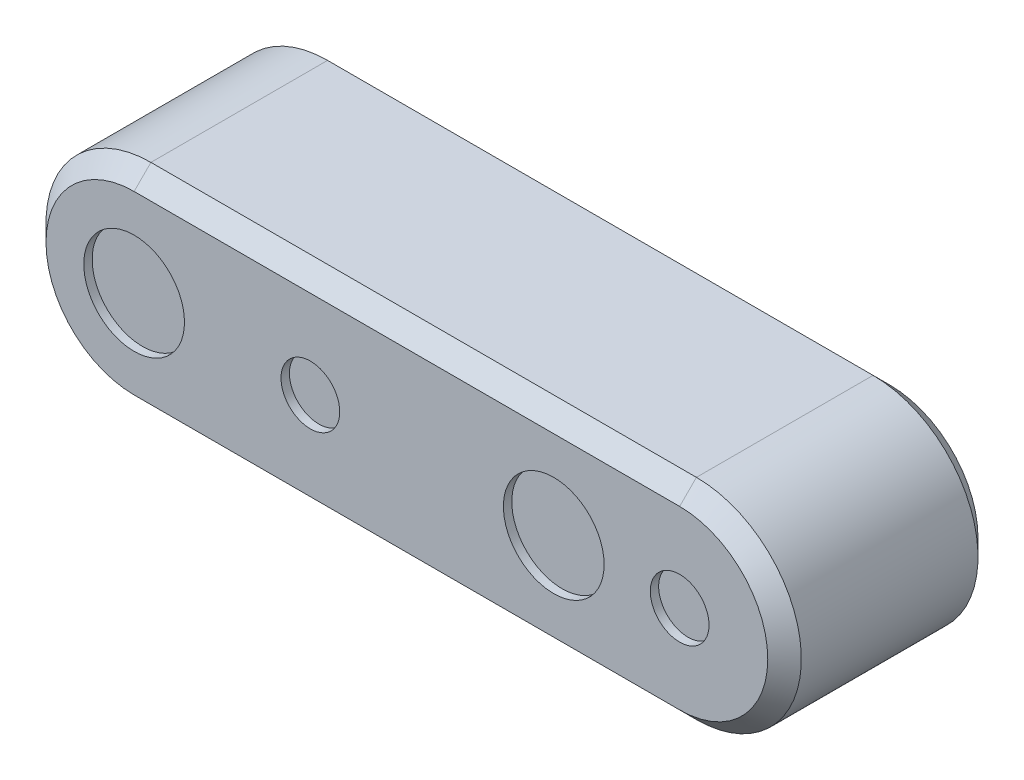
from build123d import *

# Parameters (mm, degrees)
BOSS_EXTRUDE1_DEPTH      = 12.525
BOSS_EXTRUDE1_DEPTH_BACK = 12.525
SKETCH2_R                = 6
SKETCH2_R_2              = 3.5
CUT_EXTRUDE1_DEPTH       = 1
SKETCH3_R                = 1.6
CUT_EXTRUDE2_DEPTH       = 3
CHAMFER1_SIZE            = 2


with BuildPart() as part:
    # Sketch1 → Boss-Extrude1 (new, two sides: drawn at the far end of the back side and taken through both)
    with BuildSketch(Plane.XY.offset(-BOSS_EXTRUDE1_DEPTH_BACK)):
        with BuildLine():
            Line((-32.5, 12.5), (32.5, 12.5))
            ThreePointArc((32.5, 12.5), (45, 0), (32.5, -12.5))
            Line((32.5, -12.5), (-32.5, -12.5))
            ThreePointArc((-32.5, -12.5), (-45, 0), (-32.5, 12.5))
        make_face()
    extrude(amount=BOSS_EXTRUDE1_DEPTH + BOSS_EXTRUDE1_DEPTH_BACK)

    # Sketch2 → Cut-Extrude1 (cut)
    with BuildSketch(Plane.XY.offset(12.525)):
        with Locations((-32.5, 0)):
            Circle(SKETCH2_R)
        with Locations((-11.5, 0)):
            Circle(SKETCH2_R_2)
        with Locations((17.5, 0)):
            Circle(SKETCH2_R)
        with Locations((32.5, 0)):
            Circle(SKETCH2_R_2)
    extrude(amount=-CUT_EXTRUDE1_DEPTH, mode=Mode.SUBTRACT)

    # Sketch3 → Cut-Extrude2 (cut)
    with BuildSketch(Plane(origin=(0, 0, -12.525), x_dir=(-1, 0, 0), z_dir=(0, 0, -1))):
        with Locations((22.5, 0)):
            Circle(SKETCH3_R)
        with Locations((-22.5, 0)):
            Circle(SKETCH3_R)
    extrude(amount=-CUT_EXTRUDE2_DEPTH, mode=Mode.SUBTRACT)

    # Chamfer1
    chamfer1_edges = [part.edges().sort_by_distance(p)[0] for p in [
        (0, -12.5, -12.525),
        (45, 0, -12.525),
        (-45, 0, -12.525),
        (0, 12.5, -12.525),
        (0, -12.5, 12.525),
        (45, 0, 12.525),
        (-45, 0, 12.525),
        (0, 12.5, 12.525),
    ]]
    chamfer(chamfer1_edges, length=CHAMFER1_SIZE)


solid = part.part
